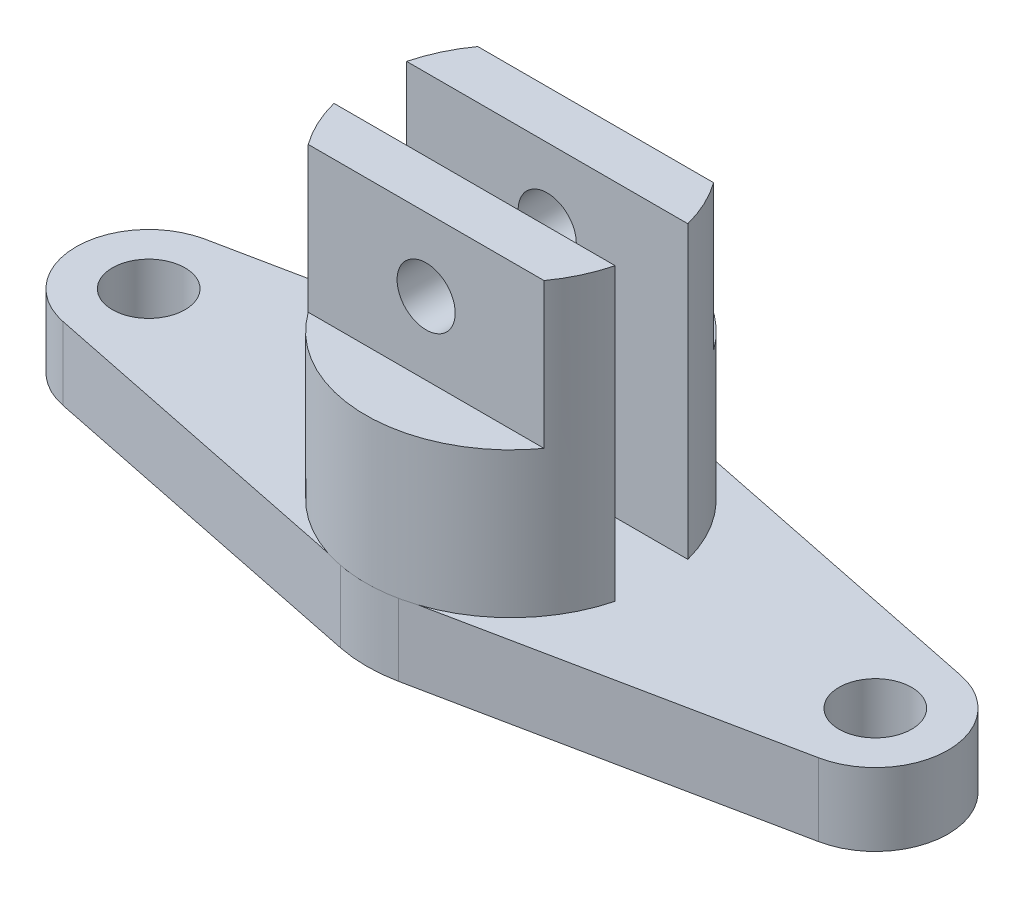
from build123d import *

# Parameters (mm, degrees)
BOSS_EXTRUDE1_DEPTH = 15
BOSS_EXTRUDE2_DEPTH = 60
CUT_EXTRUDE1_DEPTH  = 30
SKETCH4_R           = 6
CUT_EXTRUDE2_DEPTH  = 64
SKETCH5_R           = 7.5
CUT_EXTRUDE3_DEPTH  = 64


with BuildPart() as part:
    # Sketch1 → Boss-Extrude1 (new body)
    with BuildSketch(Plane(origin=(0, 0, 0), x_dir=(1, 0, 0), z_dir=(0, 1, 0))):
        with BuildLine():
            Line((-78, 14.922292207), (-6, 29.619230664))
            ThreePointArc((-6, 29.619230664), (0, 30.22535375), (6, 29.619230664))
            Line((6, 29.619230664), (78, 14.922292207))
            ThreePointArc((78, 14.922292207), (90, 0.22535375), (78, -14.471584706))
            Line((78, -14.471584706), (6, -29.168523163))
            ThreePointArc((6, -29.168523163), (0, -29.77464625), (-6, -29.168523163))
            Line((-6, -29.168523163), (-78, -14.471584706))
            ThreePointArc((-78, -14.471584706), (-90, 0.22535375), (-78, 14.922292207))
        make_face()
    extrude(amount=BOSS_EXTRUDE1_DEPTH)

    # Sketch2 → Boss-Extrude2 (add)
    with BuildSketch(Plane(origin=(0, 15, 0), x_dir=(1, 0, 0), z_dir=(0, 1, 0))):
        with BuildLine():
            Line((-29.023299464, 7.5), (29.023299464, 7.5))
            ThreePointArc((29.023299464, 7.5), (0, 29.976689473), (-29.023299464, 7.5))
        make_face()
        with BuildLine():
            Line((-29.023299464, -7.5), (29.023299464, -7.5))
            ThreePointArc((29.023299464, -7.5), (0, -29.976689473), (-29.023299464, -7.5))
        make_face()
    extrude(amount=BOSS_EXTRUDE2_DEPTH)

    # Sketch3 → Cut-Extrude1 (cut)
    with BuildSketch(Plane(origin=(0, 75, 0), x_dir=(1, 0, 0), z_dir=(0, 1, 0))):
        with BuildLine():
            Line((-24.366985862, 17.5), (24.366985862, 17.5))
            ThreePointArc((24.366985862, 17.5), (0, 30), (-24.366985862, 17.5))
        make_face()
        with BuildLine():
            Line((-24.366985862, -17.5), (24.366985862, -17.5))
            ThreePointArc((24.366985862, -17.5), (0, -30), (-24.366985862, -17.5))
        make_face()
    extrude(amount=-CUT_EXTRUDE1_DEPTH, mode=Mode.SUBTRACT)

    # Sketch4 → Cut-Extrude2 (cut)
    with BuildSketch(Plane.XY.offset(17.5)):
        with Locations((0, 60)):
            Circle(SKETCH4_R)
    extrude(amount=-CUT_EXTRUDE2_DEPTH, mode=Mode.SUBTRACT)

    # Sketch5 → Cut-Extrude3 (cut)
    with BuildSketch(Plane(origin=(0, 15, 0), x_dir=(1, 0, 0), z_dir=(0, 1, 0))):
        with Locations(Location((-75, 0.22535375, 0), (0, 0, 270))):
            Circle(SKETCH5_R)
        with Locations(Location((75, 0.22535375, 0), (0, 0, 270))):
            Circle(SKETCH5_R)
    extrude(amount=-CUT_EXTRUDE3_DEPTH, mode=Mode.SUBTRACT)


solid = part.part
